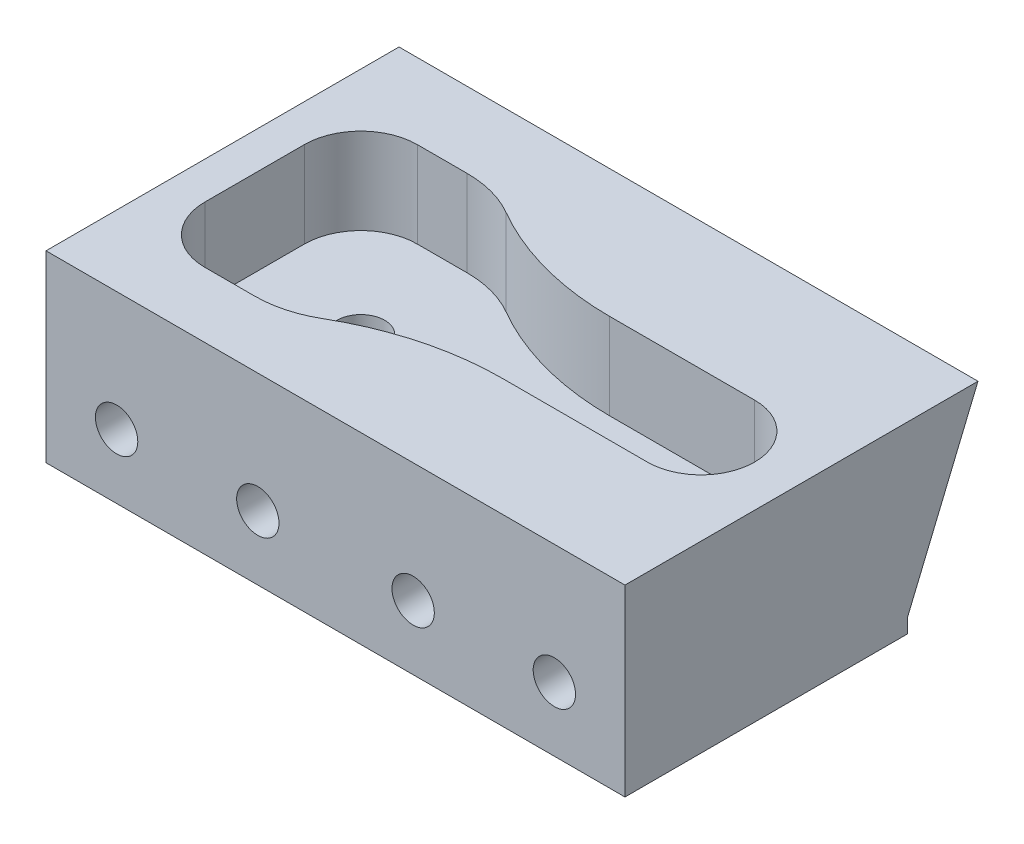
from build123d import *

# Parameters (mm, degrees)
SKETCH1_W                                           = 41
SKETCH1_H                                           = 25
BOSS_EXTRUDE1_DEPTH                                 = 13
SKETCH2_R                                           = 1.5
CUT_EXTRUDE1_DEPTH                                  = 50.749371855
LPATTERN1_COUNT                                     = 2
LPATTERN1_PITCH                                     = 10
LPATTERN3_COUNT                                     = 2
LPATTERN3_PITCH                                     = 21
SKETCH8_R                                           = 1.5
CUT_EXTRUDE5_DEPTH                                  = 8
SKETCH3_R                                           = 7.525
CUT_EXTRUDE2_DEPTH                                  = 6.1
CBORE_FOR_M3_HEX_SOCKET_HEAD_CAP_SCREW1_D           = 3.4
CBORE_FOR_M3_HEX_SOCKET_HEAD_CAP_SCREW1_CBORE_D     = 6
CBORE_FOR_M3_HEX_SOCKET_HEAD_CAP_SCREW1_CBORE_DEPTH = 3.4
FILLET1_R                                           = 20
CUT_EXTRUDE4_DEPTH                                  = 50.749371855
CUT_EXTRUDE4_DEPTH_BACK                             = 50.749371855
BOSS_EXTRUDE3_START                                 = 0.2
BOSS_EXTRUDE3_DEPTH                                 = 0.2
LPATTERN2_COUNT                                     = 2
LPATTERN2_PITCH                                     = 24.09


with BuildPart() as part:
    # Sketch1 → Boss-Extrude1 (new body)
    with BuildSketch(Plane(origin=(0, 0, 0), x_dir=(1, 0, 0), z_dir=(0, 1, 0))):
        with Locations((20.5, 12.5)):
            Rectangle(SKETCH1_W, SKETCH1_H)
    extrude(amount=BOSS_EXTRUDE1_DEPTH)

    # Sketch2 → Cut-Extrude1 (cut, through all)
    with BuildSketch(Plane.XY):
        with Locations((5, 4.545)):
            Circle(SKETCH2_R)
    cut_extrude1 = extrude(amount=-CUT_EXTRUDE1_DEPTH, mode=Mode.SUBTRACT)

    # LPattern1: Cut-Extrude1 ×2
    with Locations(*[(i * LPATTERN1_PITCH, 0, 0) for i in range(1, LPATTERN1_COUNT)]):
        add(cut_extrude1, mode=Mode.SUBTRACT)

    # LPattern3: Cut-Extrude1 ×2
    with Locations(*[(i * LPATTERN3_PITCH, 0, 0) for i in range(1, LPATTERN3_COUNT)]):
        add(cut_extrude1, mode=Mode.SUBTRACT)

    # Sketch8 → Cut-Extrude5 (cut)
    with BuildSketch(Plane.XY):
        with Locations((36, 4.545)):
            Circle(SKETCH8_R)
    extrude(amount=-CUT_EXTRUDE5_DEPTH, mode=Mode.SUBTRACT)

    # Sketch3 → Cut-Extrude2 (cut)
    with BuildSketch(Plane(origin=(0, 13, 0), x_dir=(1, 0, 0), z_dir=(0, 1, 0))):
        with Locations((10.16, 12.135)):
            Circle(SKETCH3_R)
        with BuildLine():
            Line((34.25, 8.335), (10.16, 8.335))
            ThreePointArc((10.16, 8.335), (6.36, 12.135), (10.16, 15.935))
            Line((10.16, 15.935), (34.25, 15.935))
            ThreePointArc((34.25, 15.935), (38.05, 12.135), (34.25, 8.335))
        make_face()
        with BuildLine():
            Line((10.16, 4.61), (6.635, 4.61))
            ThreePointArc((6.635, 4.61), (3.806572875, 5.781572875), (2.635, 8.61))
            Line((2.635, 8.61), (2.635, 15.66))
            ThreePointArc((2.635, 15.66), (3.806572875, 18.488427125), (6.635, 19.66))
            Line((6.635, 19.66), (10.16, 19.66))
            Line((10.16, 19.66), (10.16, 4.61))
        make_face()
    extrude(amount=-CUT_EXTRUDE2_DEPTH, mode=Mode.SUBTRACT)

    # CBORE for M3 Hex Socket Head Cap Screw1 (through all)
    with Locations(Plane(origin=(0, 0, 0), x_dir=(-1, 0, 0), z_dir=(0, -1, 0))):
        with Locations((-34.25, 12.135), (-10.16, 12.135)):
            CounterBoreHole(CBORE_FOR_M3_HEX_SOCKET_HEAD_CAP_SCREW1_D / 2, CBORE_FOR_M3_HEX_SOCKET_HEAD_CAP_SCREW1_CBORE_D / 2, CBORE_FOR_M3_HEX_SOCKET_HEAD_CAP_SCREW1_CBORE_DEPTH)

    # Fillet1
    fillet1_edges = [part.edges().sort_by_distance(p)[0] for p in [
        (16.655046189, 9.95, -15.935),
        (16.655046189, 9.95, -8.335),
    ]]
    fillet(fillet1_edges, radius=FILLET1_R)

    # Sketch7 → Cut-Extrude4 (cut, two sides: drawn at the far end of the back side and taken through both)
    with BuildSketch(Plane.ZY.offset(-CUT_EXTRUDE4_DEPTH_BACK)):
        Polygon((-50.521542775, 74.251702659), (-25, 13), (-20, 1), (-20, 0), (-20, -66.356011214), (-149.691728644, -94.508034559), (-180.213271419, 46.099679315), align=None)
    extrude(amount=CUT_EXTRUDE4_DEPTH + CUT_EXTRUDE4_DEPTH_BACK, mode=Mode.SUBTRACT)

    # Sketch9 → Boss-Extrude3 (add)
    with BuildSketch(Plane.XZ.offset(-3.4).offset(BOSS_EXTRUDE3_START)):
        with BuildLine():
            Line((8.46, -14.606841419), (8.46, -9.663158581))
            ThreePointArc((8.46, -9.663158581), (7.16, -12.135), (8.46, -14.606841419))
        make_face()
        with BuildLine():
            ThreePointArc((13.16, -12.135), (12.815183609, -10.738575996), (11.86, -9.663158581))
            Line((11.86, -9.663158581), (11.86, -14.606841419))
            ThreePointArc((11.86, -14.606841419), (12.815183609, -13.531424004), (13.16, -12.135))
        make_face()
    boss_extrude3 = extrude(amount=-BOSS_EXTRUDE3_DEPTH)

    # LPattern2: Boss-Extrude3 ×2
    with Locations(*[(i * LPATTERN2_PITCH, 0, 0) for i in range(1, LPATTERN2_COUNT)]):
        add(boss_extrude3)


solid = part.part
